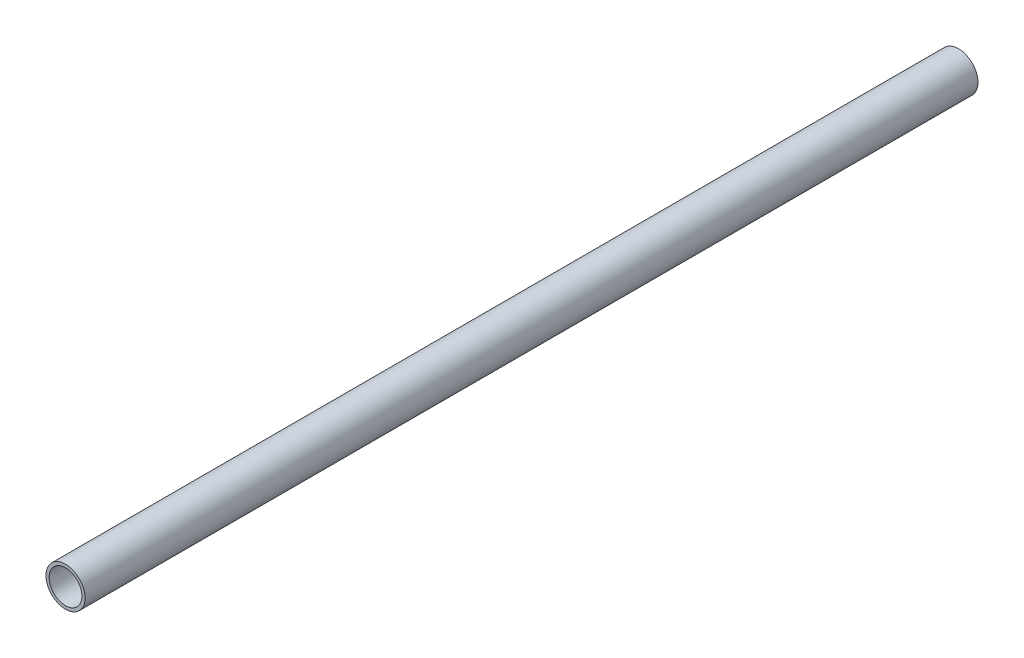
from build123d import *

# Parameters (mm, degrees)
CROQUIS1_R              = 12.5
CROQUIS1_R_2            = 10.5
SALIENTE_EXTRUIR1_DEPTH = 571


with BuildPart() as part:
    # Croquis1 → Saliente-Extruir1 (new body)
    with BuildSketch(Plane.XY):
        Circle(CROQUIS1_R)
        Circle(CROQUIS1_R_2, mode=Mode.SUBTRACT)
    extrude(amount=SALIENTE_EXTRUIR1_DEPTH)


solid = part.part
